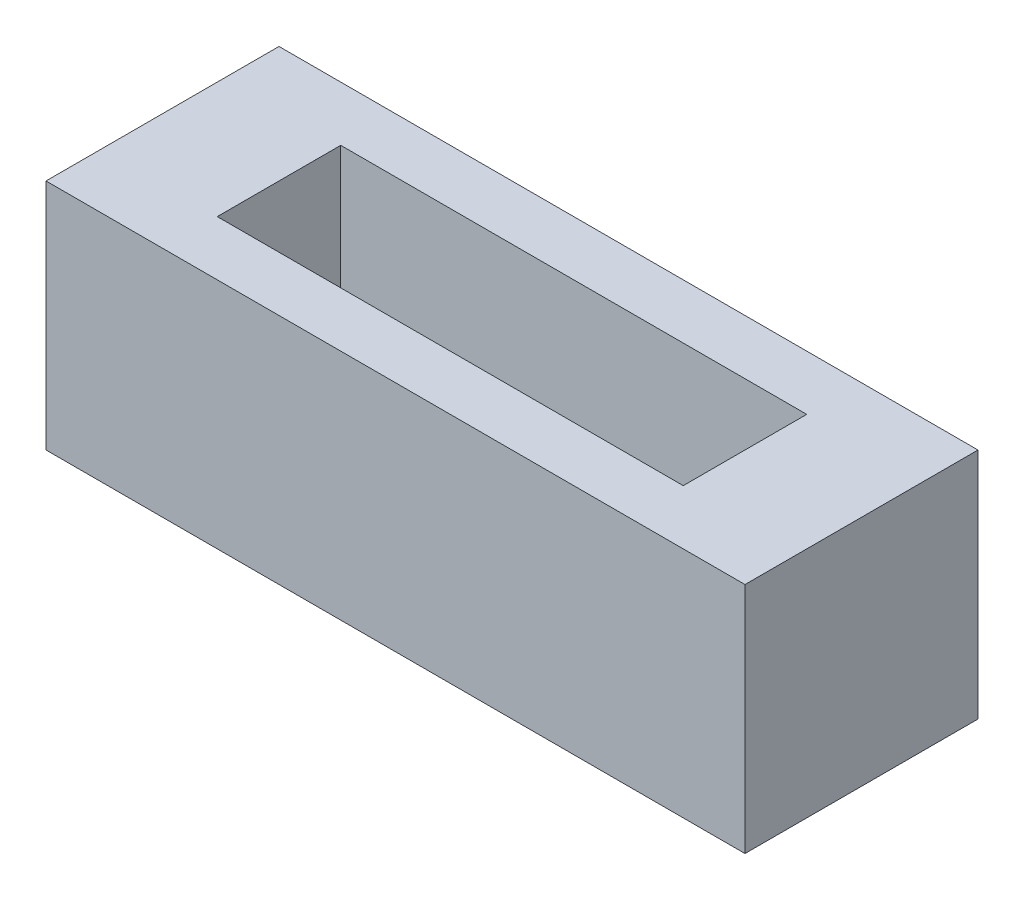
from build123d import *

# Parameters (mm, degrees)
SKETCH1_W           = 38.1
SKETCH1_H           = 12.7
BOSS_EXTRUDE1_DEPTH = 12.7
SKETCH2_W           = 25.4
SKETCH2_H           = 6.731
CUT_EXTRUDE1_DEPTH  = 12.7


with BuildPart() as part:
    # Sketch1 → Boss-Extrude1 (new body)
    with BuildSketch(Plane(origin=(0, 0, 0), x_dir=(1, 0, 0), z_dir=(0, 1, 0))):
        Rectangle(SKETCH1_W, SKETCH1_H)
    extrude(amount=BOSS_EXTRUDE1_DEPTH)

    # Sketch2 → Cut-Extrude1 (cut)
    with BuildSketch(Plane(origin=(0, 12.7, 0), x_dir=(1, 0, 0), z_dir=(0, 1, 0))):
        Rectangle(SKETCH2_W, SKETCH2_H)
    extrude(amount=-CUT_EXTRUDE1_DEPTH, mode=Mode.SUBTRACT)


solid = part.part
